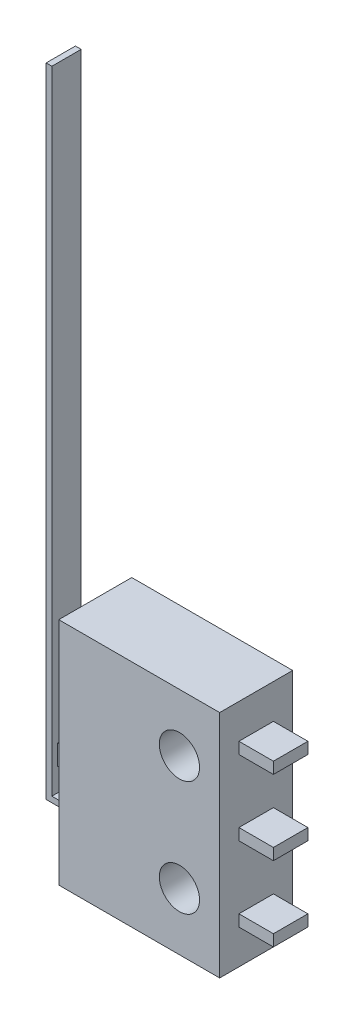
from build123d import *

# Parameters (mm, degrees)
SKETCH1_W             = 14
SKETCH1_H             = 20
BOSS_EXTRUDE1_DEPTH   = 6.35
SKETCH2_W             = 2.55
SKETCH2_H             = 1.754165379
BOSS_EXTRUDE2_DEPTH   = 2
SKETCH3_W             = 2.55
SKETCH3_H             = 0.5
BOSS_EXTRUDE3_DEPTH   = 3
SKETCH4_W             = 0.5
SKETCH4_H             = 2.55
BOSS_EXTRUDE4_DEPTH   = 55
SKETCH5_W             = 3
SKETCH5_H             = 1
BOSS_EXTRUDE5_DEPTH   = 3
F_3_0MM_DOWEL_HOLE1_D = 3.5


with BuildPart() as part:
    # Sketch1 → Boss-Extrude1 (new body)
    with BuildSketch(Plane.XY):
        with Locations((7, 10)):
            Rectangle(SKETCH1_W, SKETCH1_H)
    extrude(amount=-BOSS_EXTRUDE1_DEPTH)

    # Sketch2 → Boss-Extrude2 (add)
    with BuildSketch(Plane.ZY):
        with Locations((-3.175, 7.877082689)):
            Rectangle(SKETCH2_W, SKETCH2_H)
    extrude(amount=BOSS_EXTRUDE2_DEPTH)

    # Sketch3 → Boss-Extrude3 (add)
    with BuildSketch(Plane.ZY):
        with Locations((-3.175, 4.25)):
            Rectangle(SKETCH3_W, SKETCH3_H)
    extrude(amount=BOSS_EXTRUDE3_DEPTH)

    # Sketch4 → Boss-Extrude4 (add)
    with BuildSketch(Plane(origin=(0, 4.5, 0), x_dir=(1, 0, 0), z_dir=(0, 1, 0))):
        with Locations((-2.75, 3.175)):
            Rectangle(SKETCH4_W, SKETCH4_H)
    extrude(amount=BOSS_EXTRUDE4_DEPTH)

    # Sketch5 → Boss-Extrude5 (add)
    with BuildSketch(Plane(origin=(14, 0, 0), x_dir=(0, 0, -1), z_dir=(1, 0, 0))):
        with Locations((3.175, 3.5)):
            Rectangle(SKETCH5_W, SKETCH5_H)
        with Locations((3.175, 10)):
            Rectangle(SKETCH5_W, SKETCH5_H)
        with Locations((3.175, 16.5)):
            Rectangle(SKETCH5_W, SKETCH5_H)
    extrude(amount=BOSS_EXTRUDE5_DEPTH)

    # Ø3.0mm Dowel Hole1 (through all)
    with Locations(Plane(origin=(10.5, 15, 0), x_dir=(1, 0, 0), z_dir=(0, 0, 1))):
        with Locations((0, 0), (0, -10)):
            Hole(F_3_0MM_DOWEL_HOLE1_D / 2)


solid = part.part
